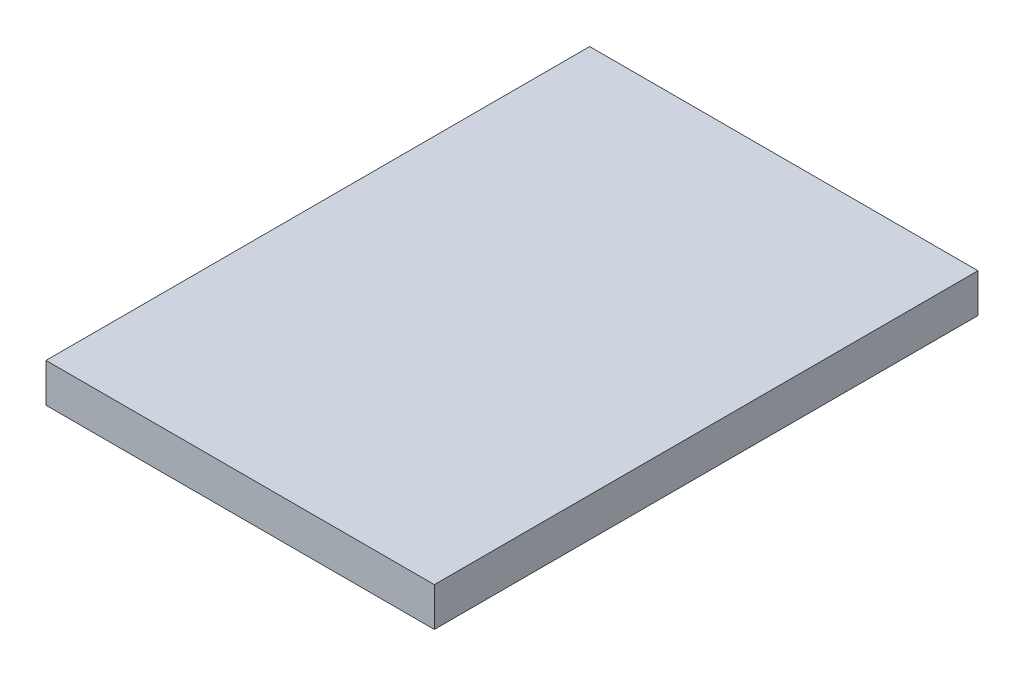
from build123d import *

# Parameters (mm, degrees)
SKETCH1_W           = 31.75
SKETCH1_H           = 44.45
BOSS_EXTRUDE1_DEPTH = 3.175


with BuildPart() as part:
    # Sketch1 → Boss-Extrude1 (new body)
    with BuildSketch(Plane(origin=(0, 0, 0), x_dir=(1, 0, 0), z_dir=(0, 1, 0))):
        with Locations((-15.875, 22.225)):
            Rectangle(SKETCH1_W, SKETCH1_H)
    extrude(amount=BOSS_EXTRUDE1_DEPTH)


solid = part.part
